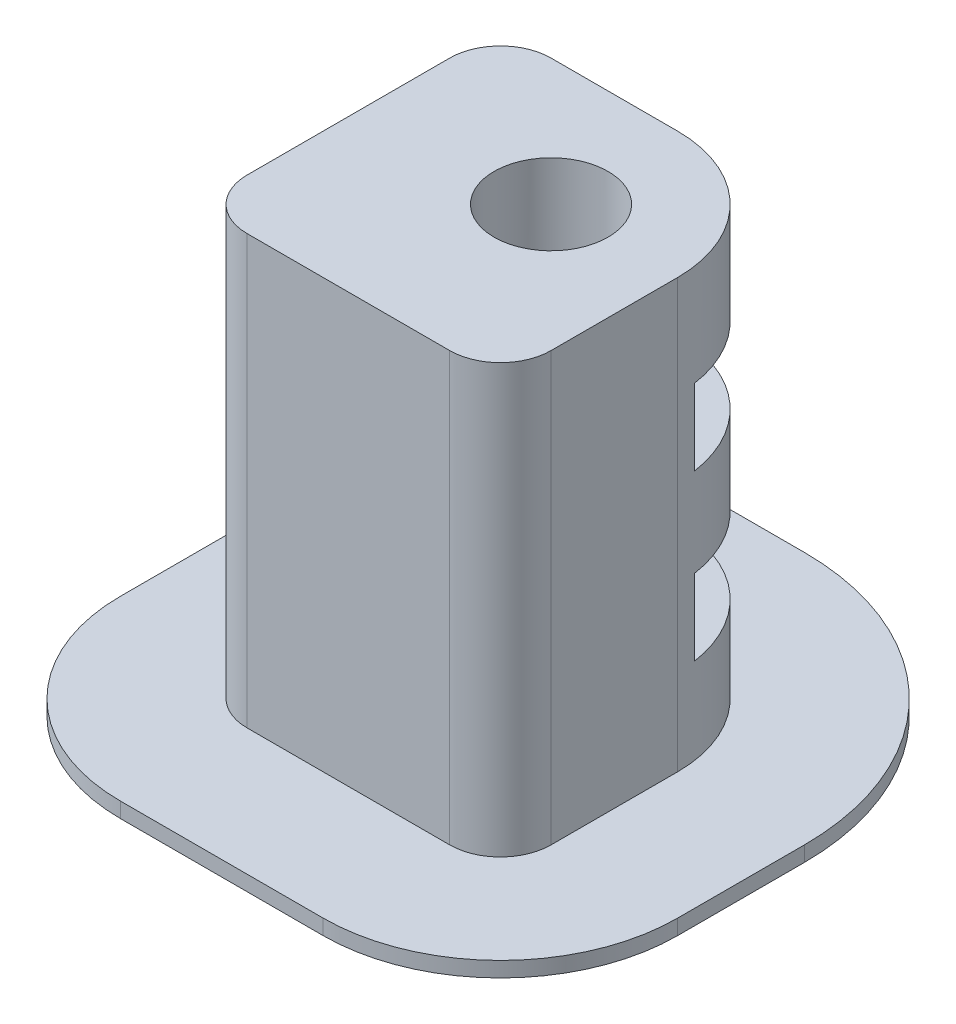
from build123d import *

# Parameters (mm, degrees)
SKETCH1_R           = 1.6
BOSS_EXTRUDE1_DEPTH = 8.75
FILLET1_R           = 2
CUT_EXTRUDE1_START  = 4.75
CUT_EXTRUDE1_DEPTH  = 3
CUT_EXTRUDE2_START  = -4.75
CUT_EXTRUDE2_DEPTH  = 3
SKETCH3_R           = 2.25
CUT_EXTRUDE3_DEPTH  = 7
SKETCH4_R           = 1.6
BOSS_EXTRUDE3_DEPTH = 0.6


with BuildPart() as part:
    # Sketch1 → Boss-Extrude1 (new, symmetric)
    with BuildSketch(Plane(origin=(0, 0, 0), x_dir=(1, 0, 0), z_dir=(0, 1, 0))):
        with BuildLine():
            Line((0, 5), (-7, 5))
            Line((-7, 5), (-7, -7))
            Line((-7, -7), (5, -7))
            Line((5, -7), (5, 0))
            ThreePointArc((5, 0), (3.535533906, 3.535533906), (0, 5))
        make_face()
        with Locations(Location((0, 0, 0), (0, 0, 270))):
            Circle(SKETCH1_R, mode=Mode.SUBTRACT)
    extrude(amount=BOSS_EXTRUDE1_DEPTH, both=True)

    # Fillet1
    fillet1_edges = [part.edges().sort_by_distance(p)[0] for p in [
        (5, 0, 7),
        (-7, 0, 7),
        (-7, 0, -5),
    ]]
    fillet(fillet1_edges, radius=FILLET1_R)

    # Sketch2 → Cut-Extrude1 (cut)
    with BuildSketch(Plane(origin=(0, 0, 0), x_dir=(1, 0, 0), z_dir=(0, 1, 0)).offset(CUT_EXTRUDE1_START)):
        Polygon((-0.896575472, 3.346065215), (0.757359313, 5), (5, 5), (5, 0.757359313), (3.346065215, -0.896575472), (0.896575472, -3.346065215), (-2.449489743, -2.449489743), (-3.346065215, 0.896575472), align=None)
    extrude(amount=-CUT_EXTRUDE1_DEPTH, mode=Mode.SUBTRACT)

    # Sketch2<2> → Cut-Extrude2 (cut)
    with BuildSketch(Plane(origin=(0, 0, 0), x_dir=(1, 0, 0), z_dir=(0, 1, 0)).offset(CUT_EXTRUDE2_START)):
        Polygon((-0.896575472, 3.346065215), (0.757359313, 5), (5, 5), (5, 0.757359313), (3.346065215, -0.896575472), (0.896575472, -3.346065215), (-2.449489743, -2.449489743), (-3.346065215, 0.896575472), align=None)
    extrude(amount=CUT_EXTRUDE2_DEPTH, mode=Mode.SUBTRACT)

    # Sketch3 → Cut-Extrude3 (cut)
    with BuildSketch(Plane(origin=(0, 8.75, 0), x_dir=(1, 0, 0), z_dir=(0, 1, 0))):
        with Locations(Location((0, 0, 0), (0, 0, 270))):
            Circle(SKETCH3_R)
    extrude(amount=-CUT_EXTRUDE3_DEPTH, mode=Mode.SUBTRACT)

    # Sketch4 → Boss-Extrude3 (add)
    with BuildSketch(Plane.XZ.offset(8.75)):
        with BuildLine():
            Line((10, 0), (10, 5))
            ThreePointArc((10, 5), (7.949747468, 9.949747468), (3, 12))
            Line((3, 12), (-5, 12))
            ThreePointArc((-5, 12), (-9.949747468, 9.949747468), (-12, 5))
            Line((-12, 5), (-12, -3))
            ThreePointArc((-12, -3), (-9.949747468, -7.949747468), (-5, -10))
            Line((-5, -10), (0, -10))
            ThreePointArc((0, -10), (7.071067812, -7.071067812), (10, 0))
        make_face()
        with Locations(Location((0, 0, 0), (0, 0, 270))):
            Circle(SKETCH4_R, mode=Mode.SUBTRACT)
    extrude(amount=-BOSS_EXTRUDE3_DEPTH)


solid = part.part
